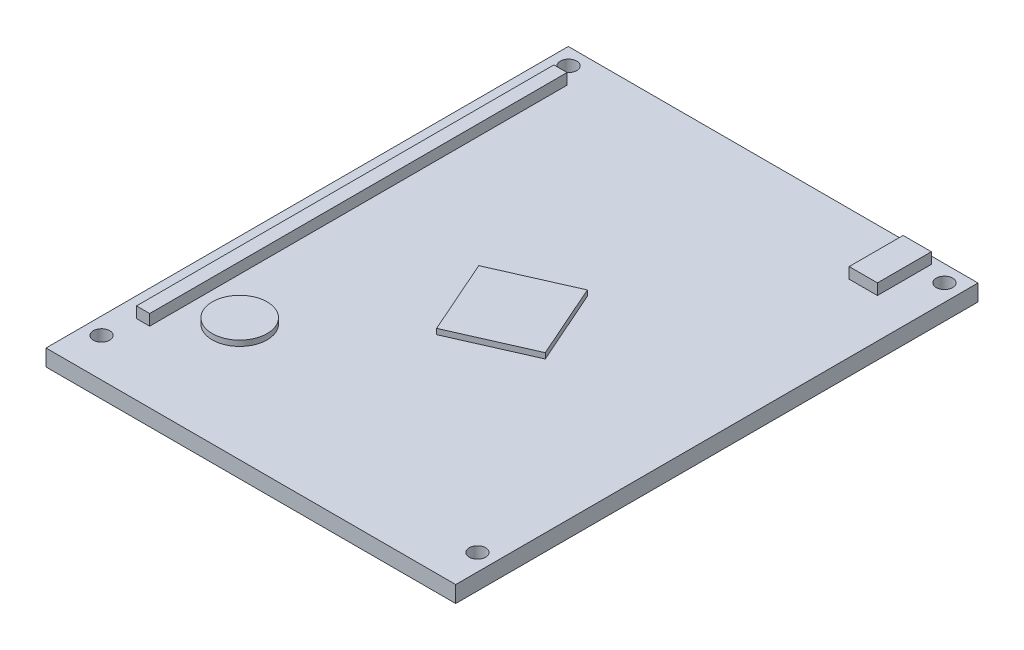
from build123d import *

# Parameters (mm, degrees)
SKETCH_1_W      = 74.6
SKETCH_1_H      = 95.1
SKETCH_1_R      = 1.5
EXTRUDE_1_DEPTH = 3
EXTRUDE_2_DEPTH = 1
SKETCH_3_R      = 5
EXTRUDE_3_DEPTH = 1
SKETCH_4_W      = 2.4
SKETCH_4_H      = 76
SKETCH_4_W_2    = 5.142957709
SKETCH_4_H_2    = 9.820324755
EXTRUDE_4_DEPTH = 2


with BuildPart() as part:
    # 草图1 → 凸台-拉伸1 (new body)
    with BuildSketch(Plane(origin=(0, 0, 0), x_dir=(1, 0, 0), z_dir=(0, 1, 0))):
        Rectangle(SKETCH_1_W, SKETCH_1_H)
        with Locations(Location((-34.225, -40.515, 0), (0, 0, 270))):
            Circle(SKETCH_1_R, mode=Mode.SUBTRACT)
        with Locations(Location((-34.225, 44.515, 0), (0, 0, 270))):
            Circle(SKETCH_1_R, mode=Mode.SUBTRACT)
        with Locations(Location((34.225, 44.515, 0), (0, 0, 270))):
            Circle(SKETCH_1_R, mode=Mode.SUBTRACT)
        with Locations(Location((34.225, -40.515, 0), (0, 0, 270))):
            Circle(SKETCH_1_R, mode=Mode.SUBTRACT)
    extrude(amount=EXTRUDE_1_DEPTH)

    # 草图2 → 凸台-拉伸2 (add)
    with BuildSketch(Plane(origin=(0, 3, 0), x_dir=(1, 0, 0), z_dir=(0, 1, 0))):
        Polygon((-9.889416187, 3.833985847), (-3.833985847, -9.889416187), (9.889416187, -3.833985847), (3.833985847, 9.889416187), align=None)
    extrude(amount=EXTRUDE_2_DEPTH)

    # 草图3 → 凸台-拉伸3 (add)
    with BuildSketch(Plane(origin=(0, 3, 0), x_dir=(1, 0, 0), z_dir=(0, 1, 0))):
        with Locations(Location((-23.440659091, -26.14028556, 0), (0, 0, 270))):
            Circle(SKETCH_3_R)
    extrude(amount=EXTRUDE_3_DEPTH)

    # 草图4 → 凸台-拉伸4 (add)
    with BuildSketch(Plane(origin=(0, 3, 0), x_dir=(1, 0, 0), z_dir=(0, 1, 0))):
        with Locations((-32.5, 3.325457596)):
            Rectangle(SKETCH_4_W, SKETCH_4_H)
        with Locations((27.55007403, 41.325457596)):
            Rectangle(SKETCH_4_W_2, SKETCH_4_H_2)
    extrude(amount=EXTRUDE_4_DEPTH)


solid = part.part
